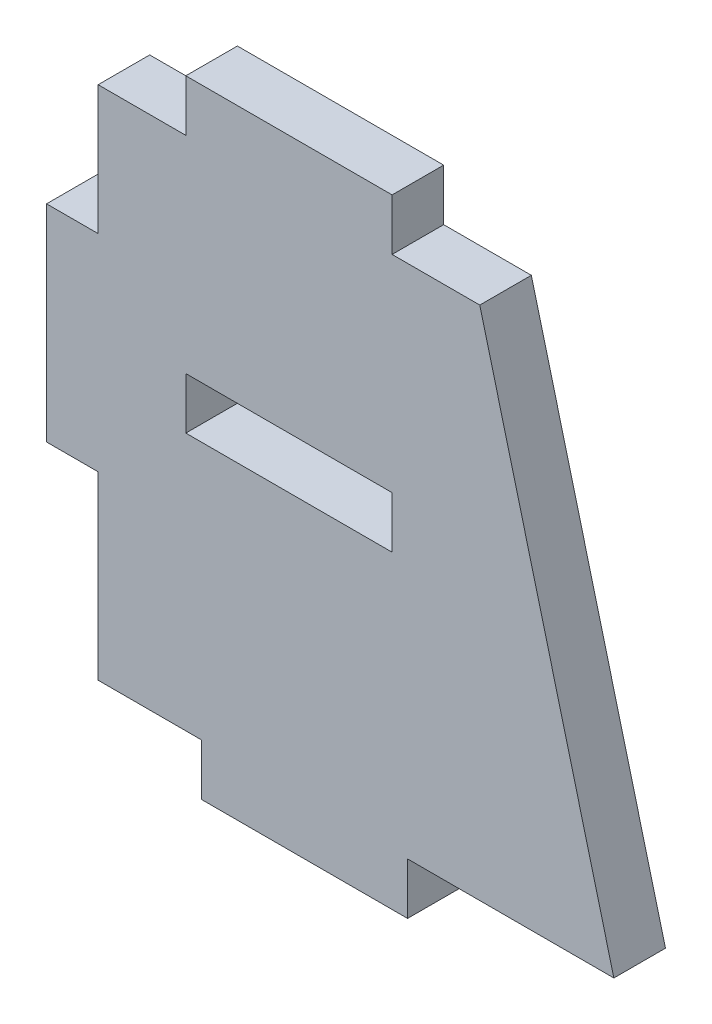
from build123d import *

# Parameters (mm, degrees)
SKETCH1_W      = 25.4
SKETCH1_H      = 6.35
EXTRUDE1_DEPTH = 6.35


with BuildPart() as part:
    # Sketch1 → Extrude1 (new body)
    with BuildSketch(Plane.XY):
        Polygon((6.35, 28.575), (0, 28.575), (0, 53.975), (6.35, 53.975), (6.35, 69.85), (17.145, 69.85), (17.145, 76.2), (42.545, 76.2), (42.545, 69.85), (53.34, 69.85), (69.85, 6.35), (44.45, 6.35), (44.45, 0), (19.05, 0), (19.05, 6.35), (6.35, 6.35), align=None)
        with Locations((29.845, 41.275)):
            Rectangle(SKETCH1_W, SKETCH1_H, mode=Mode.SUBTRACT)
    extrude(amount=EXTRUDE1_DEPTH)


solid = part.part
